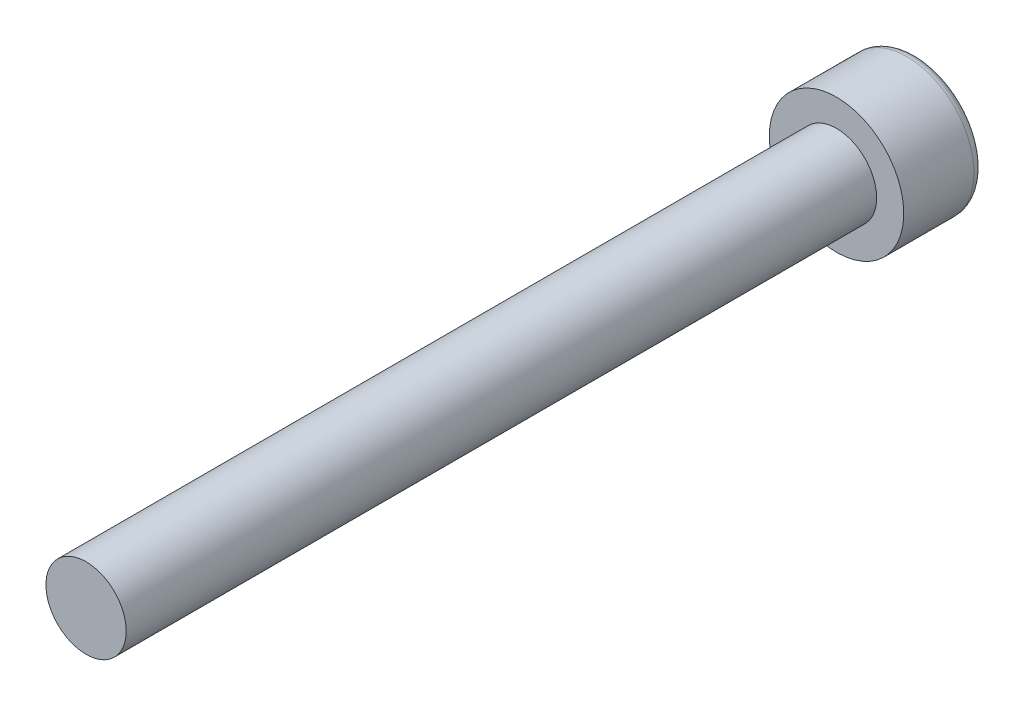
from build123d import *

# Parameters (mm, degrees)
CROQUIS1_R              = 2
SALIENTE_EXTRUIR1_DEPTH = 37.4
CROQUIS2_R              = 3.35
SALIENTE_EXTRUIR2_DEPTH = 4
CORTAR_EXTRUIR1_DEPTH   = 2.5
REDONDEO1_R             = 0.5


with BuildPart() as part:
    # Croquis1 → Saliente-Extruir1 (new body)
    with BuildSketch(Plane.XY):
        Circle(CROQUIS1_R)
    extrude(amount=SALIENTE_EXTRUIR1_DEPTH)

    # Croquis2 → Saliente-Extruir2 (add)
    with BuildSketch(Plane(origin=(0, 0, 0), x_dir=(-1, 0, 0), z_dir=(0, 0, -1))):
        Circle(CROQUIS2_R)
    extrude(amount=SALIENTE_EXTRUIR2_DEPTH)

    # Croquis3 → Cortar-Extruir1 (cut)
    with BuildSketch(Plane(origin=(0, 0, -4), x_dir=(-1, 0, 0), z_dir=(0, 0, -1))):
        Polygon((0, -1.85), (1.602146997, -0.925), (1.602146997, 0.925), (0, 1.85), (-1.602146997, 0.925), (-1.602146997, -0.925), align=None)
    extrude(amount=-CORTAR_EXTRUIR1_DEPTH, mode=Mode.SUBTRACT)

    # Redondeo1
    redondeo1_edges = [part.edges().sort_by_distance(p)[0] for p in [
        (3.35, 0, -4),
    ]]
    fillet(redondeo1_edges, radius=REDONDEO1_R)


solid = part.part
